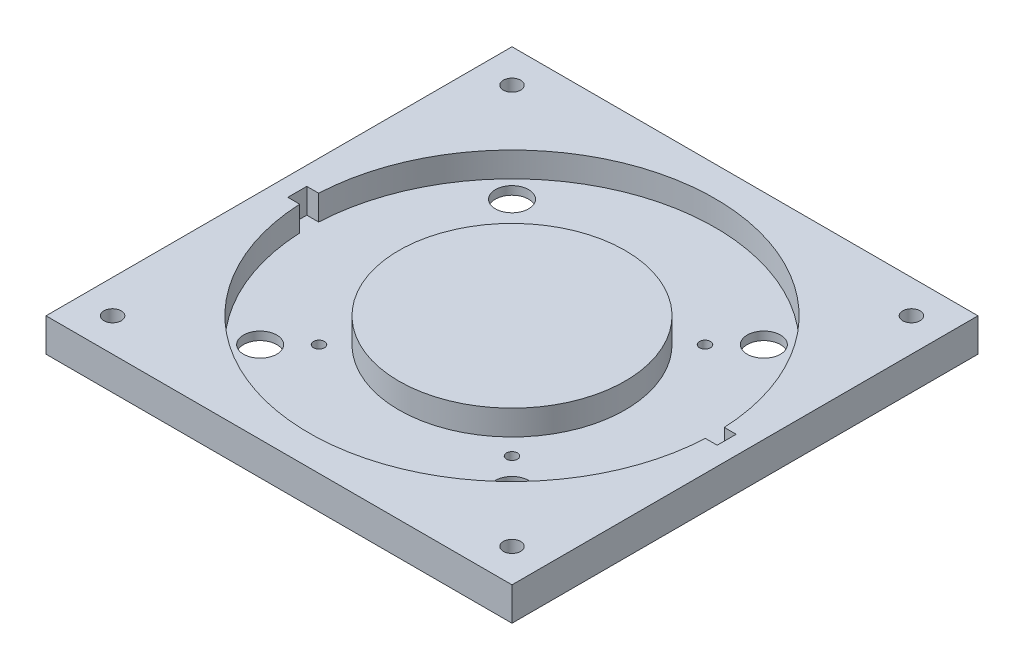
from build123d import *

# Parameters (mm, degrees)
SKETCH_1_W          = 140
SKETCH_1_H          = 140
SKETCH_1_R          = 5
SKETCH_1_R_2        = 1.65
EXTRUDE_1_DEPTH     = 10
SKETCH_2_R          = 2.6
CUT_EXTRUDE_1_DEPTH = 100.498743711
SKETCH_3_R          = 61
SKETCH_3_R_2        = 46
CUT_EXTRUDE_2_DEPTH = 7.5
SKETCH_4_R          = 46
SKETCH_4_R_2        = 34
CUT_EXTRUDE_3_DEPTH = 7.5
SKETCH_5_W          = 7
SKETCH_5_H          = 5.7
CUT_EXTRUDE_4_DEPTH = 7.5


with BuildPart() as part:
    # 草图1 → 凸台-拉伸1 (new body)
    with BuildSketch(Plane(origin=(0, 0, 0), x_dir=(1, 0, 0), z_dir=(0, 1, 0))):
        Rectangle(SKETCH_1_W, SKETCH_1_H)
        with Locations(Location((-37.830212793, 37.830212793, 0), (0, 0, 270))):
            Circle(SKETCH_1_R, mode=Mode.SUBTRACT)
        with Locations(Location((-28.991378029, 28.991378029, 0), (0, 0, 270))):
            Circle(SKETCH_1_R_2, mode=Mode.SUBTRACT)
        with Locations(Location((28.991378029, 28.991378029, 0), (0, 0, 270))):
            Circle(SKETCH_1_R_2, mode=Mode.SUBTRACT)
        with Locations(Location((37.830212793, 37.830212793, 0), (0, 0, 270))):
            Circle(SKETCH_1_R, mode=Mode.SUBTRACT)
        with Locations(Location((28.991378029, -28.991378029, 0), (0, 0, 270))):
            Circle(SKETCH_1_R_2, mode=Mode.SUBTRACT)
        with Locations(Location((37.830212793, -37.830212793, 0), (0, 0, 270))):
            Circle(SKETCH_1_R, mode=Mode.SUBTRACT)
        with Locations(Location((-28.991378029, -28.991378029, 0), (0, 0, 270))):
            Circle(SKETCH_1_R_2, mode=Mode.SUBTRACT)
        with Locations(Location((-37.830212793, -37.830212793, 0), (0, 0, 270))):
            Circle(SKETCH_1_R, mode=Mode.SUBTRACT)
    extrude(amount=EXTRUDE_1_DEPTH)

    # 草图2 → 切除-拉伸1 (cut, through all)
    with BuildSketch(Plane(origin=(0, 10, 0), x_dir=(1, 0, 0), z_dir=(0, 1, 0))):
        with Locations(Location((-60, 60, 0), (0, 0, 270))):
            Circle(SKETCH_2_R)
        with Locations(Location((60, 60, 0), (0, 0, 270))):
            Circle(SKETCH_2_R)
        with Locations(Location((60, -60, 0), (0, 0, 270))):
            Circle(SKETCH_2_R)
        with Locations(Location((-60, -60, 0), (0, 0, 270))):
            Circle(SKETCH_2_R)
    extrude(amount=-CUT_EXTRUDE_1_DEPTH, mode=Mode.SUBTRACT)

    # 草图3 → 切除-拉伸2 (cut)
    with BuildSketch(Plane(origin=(0, 10, 0), x_dir=(1, 0, 0), z_dir=(0, 1, 0))):
        with Locations(Location((0, 0, 0), (0, 0, 270))):
            Circle(SKETCH_3_R)
        with Locations(Location((0, 0, 0), (0, 0, 270))):
            Circle(SKETCH_3_R_2, mode=Mode.SUBTRACT)
    extrude(amount=-CUT_EXTRUDE_2_DEPTH, mode=Mode.SUBTRACT)

    # 草图4 → 切除-拉伸3 (cut)
    with BuildSketch(Plane(origin=(0, 10, 0), x_dir=(1, 0, 0), z_dir=(0, 1, 0))):
        Circle(SKETCH_4_R)
        with Locations(Location((0, 0, 0), (0, 0, 270))):
            Circle(SKETCH_4_R_2, mode=Mode.SUBTRACT)
    extrude(amount=-CUT_EXTRUDE_3_DEPTH, mode=Mode.SUBTRACT)

    # 草图5 → 切除-拉伸4 (cut)
    with BuildSketch(Plane(origin=(0, 10, 0), x_dir=(1, 0, 0), z_dir=(0, 1, 0))):
        with Locations((-61, 0)):
            Rectangle(SKETCH_5_W, SKETCH_5_H)
        with Locations((61, 0)):
            Rectangle(SKETCH_5_W, SKETCH_5_H)
    extrude(amount=-CUT_EXTRUDE_4_DEPTH, mode=Mode.SUBTRACT)


solid = part.part
